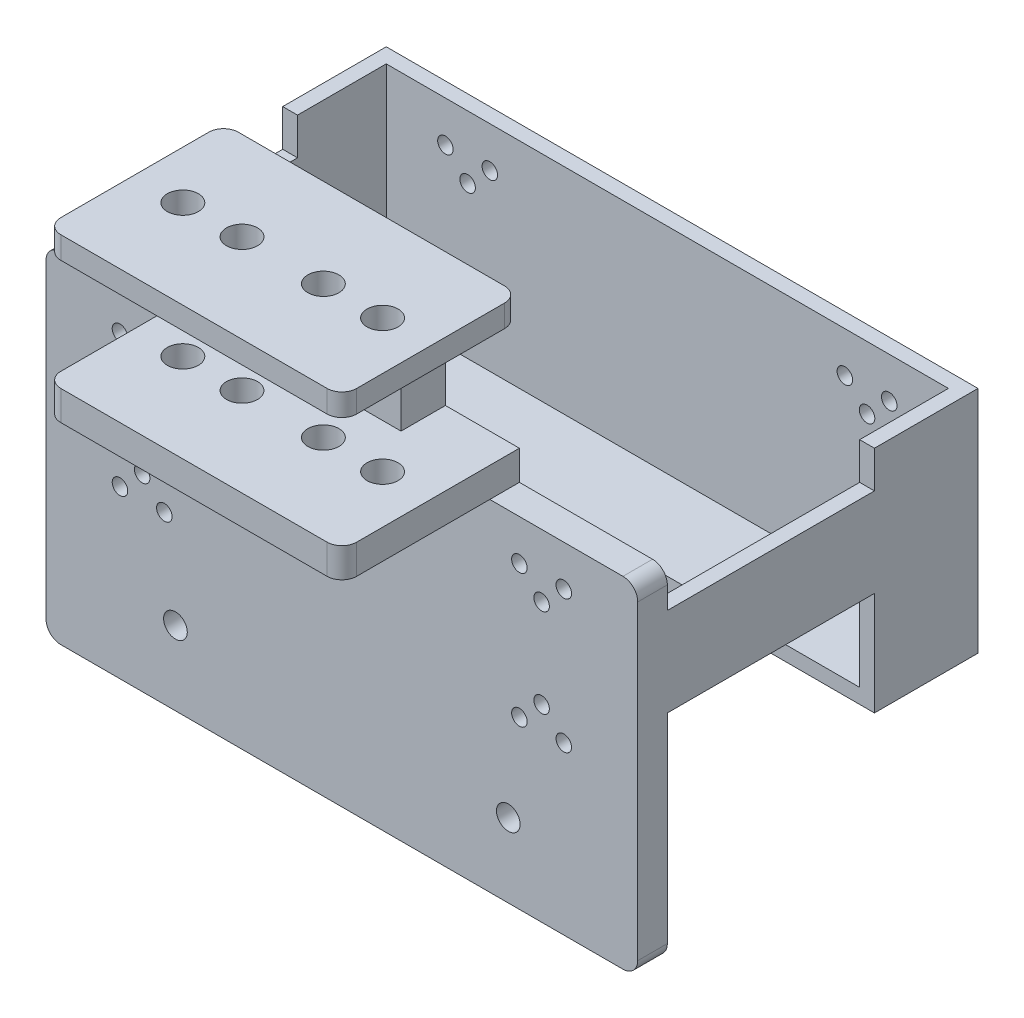
from build123d import *

# Parameters (mm, degrees)
SKETCH_1_W                      = 80
SKETCH_1_H                      = 29
EXTRUDE_1_DEPTH                 = 2
SKETCH_4_W                      = 2
SKETCH_4_H                      = 29
EXTRUDE_2_DEPTH                 = 12
SKETCH_6_W                      = 80
SKETCH_6_H                      = 14
EXTRUDE_4_DEPTH                 = 2
SKETCH_7_W                      = 2
SKETCH_7_H                      = 12
EXTRUDE_5_DEPTH                 = 28
SKETCH_8_W                      = 80
SKETCH_8_H                      = 31
EXTRUDE_6_DEPTH                 = 4
SKETCH_2_R                      = 1.05
CUT_EXTRUDE_1_DEPTH             = 62.711020086
CUT_EXTRUDE_1_DIRECTION_2_REACH = 63.711
SKETCH_12_W                     = 40
SKETCH_12_H                     = 24
EXTRUDE_9_DEPTH                 = 4
CUT_EXTRUDE_3_REACH             = 86.741
SKETCH_13_R                     = 2.1
CUT_EXTRUDE_3_DIRECTION_2_DEPTH = 85.74078121
SKETCH_14_W                     = 20
SKETCH_14_H                     = 6
EXTRUDE_10_DEPTH                = 15
SKETCH_15_W                     = 40
SKETCH_15_H                     = 24
EXTRUDE_11_DEPTH                = 3
SKETCH_16_R                     = 2.1
CUT_EXTRUDE_4_DEPTH             = 3
EXTRUDE_14_DEPTH                = 4
SKETCH_22_R                     = 1.6
CUT_EXTRUDE_5_DEPTH             = 4
FILLET_1_R                      = 2


with BuildPart() as part:
    # 草图1 → 凸台-拉伸1 (new body)
    with BuildSketch(Plane.XY):
        Rectangle(SKETCH_1_W, SKETCH_1_H)
    extrude(amount=EXTRUDE_1_DEPTH)

    # 草图4 → 凸台-拉伸2 (add)
    with BuildSketch(Plane.XY.offset(2)):
        with Locations((39, 0)):
            Rectangle(SKETCH_4_W, SKETCH_4_H)
        with Locations((-39, 0)):
            Rectangle(SKETCH_4_W, SKETCH_4_H)
    extrude(amount=EXTRUDE_2_DEPTH)

    # 草图6 → 凸台-拉伸4 (add)
    with BuildSketch(Plane.XZ.offset(14.5)):
        with Locations((0, 7)):
            Rectangle(SKETCH_6_W, SKETCH_6_H)
    extrude(amount=EXTRUDE_4_DEPTH)

    # 草图7 → 凸台-拉伸5 (add)
    with BuildSketch(Plane.XY.offset(14)):
        with Locations((-39, 3.5)):
            Rectangle(SKETCH_7_W, SKETCH_7_H)
        with Locations((39, 3.5)):
            Rectangle(SKETCH_7_W, SKETCH_7_H)
    extrude(amount=EXTRUDE_5_DEPTH)

    # 草图8 → 凸台-拉伸6 (add)
    with BuildSketch(Plane.XY.offset(42)):
        with Locations((0, -1)):
            Rectangle(SKETCH_8_W, SKETCH_8_H)
    extrude(amount=EXTRUDE_6_DEPTH)

    # 草图2 → 切除-拉伸1 (cut)
    with BuildSketch(Plane.XY.offset(2)):
        with Locations((-30, 9)):
            Circle(SKETCH_2_R)
        with Locations((-24, 9)):
            Circle(SKETCH_2_R)
        with Locations((-27, 6)):
            Circle(SKETCH_2_R)
        with Locations((-27, -6)):
            Circle(SKETCH_2_R)
        with Locations((-24, -9)):
            Circle(SKETCH_2_R)
        with Locations((-30, -9)):
            Circle(SKETCH_2_R)
        with Locations((27, -6)):
            Circle(SKETCH_2_R)
        with Locations((30, -9)):
            Circle(SKETCH_2_R)
        with Locations((24, -9)):
            Circle(SKETCH_2_R)
        with Locations((27, 6)):
            Circle(SKETCH_2_R)
        with Locations((30, 9)):
            Circle(SKETCH_2_R)
        with Locations((24, 9)):
            Circle(SKETCH_2_R)
    extrude(amount=-CUT_EXTRUDE_1_DEPTH, mode=Mode.SUBTRACT)

    # 切除-拉伸1 direction 2: up to this face of the body (flat: up to its plane)
    cut_extrude_1_direction_2_end = Plane(part.part.faces().sort_by_distance((0, -1, 46))[0])
    # 草图2 → 切除-拉伸1 direction 2 (cut, up to the picked face)
    with BuildSketch(Plane.XY.offset(2), mode=Mode.PRIVATE) as cut_extrude_1_direction_2_sk1:
        with Locations((-30, 9)):
            Circle(SKETCH_2_R)
    cut_extrude_1_direction_2_tool1 = split(extrude(cut_extrude_1_direction_2_sk1.sketch, amount=CUT_EXTRUDE_1_DIRECTION_2_REACH, mode=Mode.PRIVATE), bisect_by=cut_extrude_1_direction_2_end, keep=Keep.BOTH, mode=Mode.PRIVATE)
    # 草图2 → 切除-拉伸1 direction 2 (cut, up to the picked face)
    with BuildSketch(Plane.XY.offset(2), mode=Mode.PRIVATE) as cut_extrude_1_direction_2_sk2:
        with Locations((-24, 9)):
            Circle(SKETCH_2_R)
    cut_extrude_1_direction_2_tool2 = split(extrude(cut_extrude_1_direction_2_sk2.sketch, amount=CUT_EXTRUDE_1_DIRECTION_2_REACH, mode=Mode.PRIVATE), bisect_by=cut_extrude_1_direction_2_end, keep=Keep.BOTH, mode=Mode.PRIVATE)
    # 草图2 → 切除-拉伸1 direction 2 (cut, up to the picked face)
    with BuildSketch(Plane.XY.offset(2), mode=Mode.PRIVATE) as cut_extrude_1_direction_2_sk3:
        with Locations((-27, 6)):
            Circle(SKETCH_2_R)
    cut_extrude_1_direction_2_tool3 = split(extrude(cut_extrude_1_direction_2_sk3.sketch, amount=CUT_EXTRUDE_1_DIRECTION_2_REACH, mode=Mode.PRIVATE), bisect_by=cut_extrude_1_direction_2_end, keep=Keep.BOTH, mode=Mode.PRIVATE)
    # 草图2 → 切除-拉伸1 direction 2 (cut, up to the picked face)
    with BuildSketch(Plane.XY.offset(2), mode=Mode.PRIVATE) as cut_extrude_1_direction_2_sk4:
        with Locations((-27, -6)):
            Circle(SKETCH_2_R)
    cut_extrude_1_direction_2_tool4 = split(extrude(cut_extrude_1_direction_2_sk4.sketch, amount=CUT_EXTRUDE_1_DIRECTION_2_REACH, mode=Mode.PRIVATE), bisect_by=cut_extrude_1_direction_2_end, keep=Keep.BOTH, mode=Mode.PRIVATE)
    # 草图2 → 切除-拉伸1 direction 2 (cut, up to the picked face)
    with BuildSketch(Plane.XY.offset(2), mode=Mode.PRIVATE) as cut_extrude_1_direction_2_sk5:
        with Locations((-24, -9)):
            Circle(SKETCH_2_R)
    cut_extrude_1_direction_2_tool5 = split(extrude(cut_extrude_1_direction_2_sk5.sketch, amount=CUT_EXTRUDE_1_DIRECTION_2_REACH, mode=Mode.PRIVATE), bisect_by=cut_extrude_1_direction_2_end, keep=Keep.BOTH, mode=Mode.PRIVATE)
    # 草图2 → 切除-拉伸1 direction 2 (cut, up to the picked face)
    with BuildSketch(Plane.XY.offset(2), mode=Mode.PRIVATE) as cut_extrude_1_direction_2_sk6:
        with Locations((-30, -9)):
            Circle(SKETCH_2_R)
    cut_extrude_1_direction_2_tool6 = split(extrude(cut_extrude_1_direction_2_sk6.sketch, amount=CUT_EXTRUDE_1_DIRECTION_2_REACH, mode=Mode.PRIVATE), bisect_by=cut_extrude_1_direction_2_end, keep=Keep.BOTH, mode=Mode.PRIVATE)
    # 草图2 → 切除-拉伸1 direction 2 (cut, up to the picked face)
    with BuildSketch(Plane.XY.offset(2), mode=Mode.PRIVATE) as cut_extrude_1_direction_2_sk7:
        with Locations((27, -6)):
            Circle(SKETCH_2_R)
    cut_extrude_1_direction_2_tool7 = split(extrude(cut_extrude_1_direction_2_sk7.sketch, amount=CUT_EXTRUDE_1_DIRECTION_2_REACH, mode=Mode.PRIVATE), bisect_by=cut_extrude_1_direction_2_end, keep=Keep.BOTH, mode=Mode.PRIVATE)
    # 草图2 → 切除-拉伸1 direction 2 (cut, up to the picked face)
    with BuildSketch(Plane.XY.offset(2), mode=Mode.PRIVATE) as cut_extrude_1_direction_2_sk8:
        with Locations((30, -9)):
            Circle(SKETCH_2_R)
    cut_extrude_1_direction_2_tool8 = split(extrude(cut_extrude_1_direction_2_sk8.sketch, amount=CUT_EXTRUDE_1_DIRECTION_2_REACH, mode=Mode.PRIVATE), bisect_by=cut_extrude_1_direction_2_end, keep=Keep.BOTH, mode=Mode.PRIVATE)
    # 草图2 → 切除-拉伸1 direction 2 (cut, up to the picked face)
    with BuildSketch(Plane.XY.offset(2), mode=Mode.PRIVATE) as cut_extrude_1_direction_2_sk9:
        with Locations((24, -9)):
            Circle(SKETCH_2_R)
    cut_extrude_1_direction_2_tool9 = split(extrude(cut_extrude_1_direction_2_sk9.sketch, amount=CUT_EXTRUDE_1_DIRECTION_2_REACH, mode=Mode.PRIVATE), bisect_by=cut_extrude_1_direction_2_end, keep=Keep.BOTH, mode=Mode.PRIVATE)
    # 草图2 → 切除-拉伸1 direction 2 (cut, up to the picked face)
    with BuildSketch(Plane.XY.offset(2), mode=Mode.PRIVATE) as cut_extrude_1_direction_2_sk10:
        with Locations((27, 6)):
            Circle(SKETCH_2_R)
    cut_extrude_1_direction_2_tool10 = split(extrude(cut_extrude_1_direction_2_sk10.sketch, amount=CUT_EXTRUDE_1_DIRECTION_2_REACH, mode=Mode.PRIVATE), bisect_by=cut_extrude_1_direction_2_end, keep=Keep.BOTH, mode=Mode.PRIVATE)
    # 草图2 → 切除-拉伸1 direction 2 (cut, up to the picked face)
    with BuildSketch(Plane.XY.offset(2), mode=Mode.PRIVATE) as cut_extrude_1_direction_2_sk11:
        with Locations((30, 9)):
            Circle(SKETCH_2_R)
    cut_extrude_1_direction_2_tool11 = split(extrude(cut_extrude_1_direction_2_sk11.sketch, amount=CUT_EXTRUDE_1_DIRECTION_2_REACH, mode=Mode.PRIVATE), bisect_by=cut_extrude_1_direction_2_end, keep=Keep.BOTH, mode=Mode.PRIVATE)
    # 草图2 → 切除-拉伸1 direction 2 (cut, up to the picked face)
    with BuildSketch(Plane.XY.offset(2), mode=Mode.PRIVATE) as cut_extrude_1_direction_2_sk12:
        with Locations((24, 9)):
            Circle(SKETCH_2_R)
    cut_extrude_1_direction_2_tool12 = split(extrude(cut_extrude_1_direction_2_sk12.sketch, amount=CUT_EXTRUDE_1_DIRECTION_2_REACH, mode=Mode.PRIVATE), bisect_by=cut_extrude_1_direction_2_end, keep=Keep.BOTH, mode=Mode.PRIVATE)
    add(cut_extrude_1_direction_2_tool1.solids().sort_by(Axis((-30, 9, 2), (0, 0, 1)))[0], mode=Mode.SUBTRACT)
    add(cut_extrude_1_direction_2_tool2.solids().sort_by(Axis((-24, 9, 2), (0, 0, 1)))[0], mode=Mode.SUBTRACT)
    add(cut_extrude_1_direction_2_tool3.solids().sort_by(Axis((-27, 6, 2), (0, 0, 1)))[0], mode=Mode.SUBTRACT)
    add(cut_extrude_1_direction_2_tool4.solids().sort_by(Axis((-27, -6, 2), (0, 0, 1)))[0], mode=Mode.SUBTRACT)
    add(cut_extrude_1_direction_2_tool5.solids().sort_by(Axis((-24, -9, 2), (0, 0, 1)))[0], mode=Mode.SUBTRACT)
    add(cut_extrude_1_direction_2_tool6.solids().sort_by(Axis((-30, -9, 2), (0, 0, 1)))[0], mode=Mode.SUBTRACT)
    add(cut_extrude_1_direction_2_tool7.solids().sort_by(Axis((27, -6, 2), (0, 0, 1)))[0], mode=Mode.SUBTRACT)
    add(cut_extrude_1_direction_2_tool8.solids().sort_by(Axis((30, -9, 2), (0, 0, 1)))[0], mode=Mode.SUBTRACT)
    add(cut_extrude_1_direction_2_tool9.solids().sort_by(Axis((24, -9, 2), (0, 0, 1)))[0], mode=Mode.SUBTRACT)
    add(cut_extrude_1_direction_2_tool10.solids().sort_by(Axis((27, 6, 2), (0, 0, 1)))[0], mode=Mode.SUBTRACT)
    add(cut_extrude_1_direction_2_tool11.solids().sort_by(Axis((30, 9, 2), (0, 0, 1)))[0], mode=Mode.SUBTRACT)
    add(cut_extrude_1_direction_2_tool12.solids().sort_by(Axis((24, 9, 2), (0, 0, 1)))[0], mode=Mode.SUBTRACT)

    # 草图12 → 凸台-拉伸9 (add)
    with BuildSketch(Plane(origin=(0, 14.5, 0), x_dir=(1, 0, 0), z_dir=(0, 1, 0))):
        with Locations((0, -54)):
            Rectangle(SKETCH_12_W, SKETCH_12_H)
    extrude(amount=EXTRUDE_9_DEPTH)

    # 草图13 → 切除-拉伸3 (cut, up to next)
    with BuildSketch(Plane(origin=(0, 18.5, 0), x_dir=(1, 0, 0), z_dir=(0, 1, 0)), mode=Mode.PRIVATE) as cut_extrude_3_sk1:
        with Locations(Location((-13.5, -54, 0), (0, 0, 90))):
            Circle(SKETCH_13_R)
    cut_extrude_3_tool1 = extrude(cut_extrude_3_sk1.sketch, amount=-CUT_EXTRUDE_3_REACH, mode=Mode.PRIVATE) & part.part
    # 草图13 → 切除-拉伸3 (cut, up to next)
    with BuildSketch(Plane(origin=(0, 18.5, 0), x_dir=(1, 0, 0), z_dir=(0, 1, 0)), mode=Mode.PRIVATE) as cut_extrude_3_sk2:
        with Locations(Location((-5.5, -54, 0), (0, 0, 90))):
            Circle(SKETCH_13_R)
    cut_extrude_3_tool2 = extrude(cut_extrude_3_sk2.sketch, amount=-CUT_EXTRUDE_3_REACH, mode=Mode.PRIVATE) & part.part
    # 草图13 → 切除-拉伸3 (cut, up to next)
    with BuildSketch(Plane(origin=(0, 18.5, 0), x_dir=(1, 0, 0), z_dir=(0, 1, 0)), mode=Mode.PRIVATE) as cut_extrude_3_sk3:
        with Locations(Location((5.5, -54, 0), (0, 0, 90))):
            Circle(SKETCH_13_R)
    cut_extrude_3_tool3 = extrude(cut_extrude_3_sk3.sketch, amount=-CUT_EXTRUDE_3_REACH, mode=Mode.PRIVATE) & part.part
    # 草图13 → 切除-拉伸3 (cut, up to next)
    with BuildSketch(Plane(origin=(0, 18.5, 0), x_dir=(1, 0, 0), z_dir=(0, 1, 0)), mode=Mode.PRIVATE) as cut_extrude_3_sk4:
        with Locations(Location((13.5, -54, 0), (0, 0, 90))):
            Circle(SKETCH_13_R)
    cut_extrude_3_tool4 = extrude(cut_extrude_3_sk4.sketch, amount=-CUT_EXTRUDE_3_REACH, mode=Mode.PRIVATE) & part.part
    add(cut_extrude_3_tool1.solids().sort_by_distance((-13.5, 18.5, 54))[0], mode=Mode.SUBTRACT)
    add(cut_extrude_3_tool2.solids().sort_by_distance((-5.5, 18.5, 54))[0], mode=Mode.SUBTRACT)
    add(cut_extrude_3_tool3.solids().sort_by_distance((5.5, 18.5, 54))[0], mode=Mode.SUBTRACT)
    add(cut_extrude_3_tool4.solids().sort_by_distance((13.5, 18.5, 54))[0], mode=Mode.SUBTRACT)

    # 草图13 → 切除-拉伸3 direction 2 (cut)
    with BuildSketch(Plane(origin=(0, 18.5, 0), x_dir=(1, 0, 0), z_dir=(0, 1, 0))):
        with Locations(Location((-13.5, -54, 0), (0, 0, 90))):
            Circle(SKETCH_13_R)
        with Locations(Location((-5.5, -54, 0), (0, 0, 90))):
            Circle(SKETCH_13_R)
        with Locations(Location((5.5, -54, 0), (0, 0, 90))):
            Circle(SKETCH_13_R)
        with Locations(Location((13.5, -54, 0), (0, 0, 90))):
            Circle(SKETCH_13_R)
    extrude(amount=CUT_EXTRUDE_3_DIRECTION_2_DEPTH, mode=Mode.SUBTRACT)

    # 草图14 → 凸台-拉伸10 (add)
    with BuildSketch(Plane(origin=(0, 18.5, 0), x_dir=(1, 0, 0), z_dir=(0, 1, 0))):
        with Locations((0, -45)):
            Rectangle(SKETCH_14_W, SKETCH_14_H)
    extrude(amount=EXTRUDE_10_DEPTH)

    # 草图15 → 凸台-拉伸11 (add)
    with BuildSketch(Plane(origin=(0, 33.5, 0), x_dir=(1, 0, 0), z_dir=(0, 1, 0))):
        with Locations((0, -54)):
            Rectangle(SKETCH_15_W, SKETCH_15_H)
    extrude(amount=EXTRUDE_11_DEPTH)

    # 草图16 → 切除-拉伸4 (cut)
    with BuildSketch(Plane(origin=(0, 36.5, 0), x_dir=(1, 0, 0), z_dir=(0, 1, 0))):
        with Locations(Location((-13.5, -54, 0), (0, 0, 90))):
            Circle(SKETCH_16_R)
        with Locations(Location((-5.5, -54, 0), (0, 0, 90))):
            Circle(SKETCH_16_R)
        with Locations(Location((5.5, -54, 0), (0, 0, 90))):
            Circle(SKETCH_16_R)
        with Locations(Location((13.5, -54, 0), (0, 0, 90))):
            Circle(SKETCH_16_R)
    extrude(amount=-CUT_EXTRUDE_4_DEPTH, mode=Mode.SUBTRACT)

    # 草图21 → 凸台-拉伸14 (add)
    with BuildSketch(Plane.XY.offset(46)):
        Polygon((0, -16.5), (40, -16.5), (40, -31.5), (-40, -31.5), (-40, -16.5), align=None)
    extrude(amount=-EXTRUDE_14_DEPTH)

    # 草图22 → 切除-拉伸5 (cut)
    with BuildSketch(Plane.XY.offset(46)):
        with Locations((-22.5, -21.5)):
            Circle(SKETCH_22_R)
        with Locations((22.5, -21.5)):
            Circle(SKETCH_22_R)
    extrude(amount=-CUT_EXTRUDE_5_DEPTH, mode=Mode.SUBTRACT)

    # 圆角1
    fillet_1_edges = [part.edges().sort_by_distance(p)[0] for p in [
        (-20, 16.5, 66),
        (20, 16.5, 66),
        (-20, 35, 42),
        (-20, 35, 66),
        (20, 35, 66),
        (20, 35, 42),
        (40, -31.5, 44),
        (-40, -31.5, 44),
        (-40, 14.5, 44),
        (40, 14.5, 44),
    ]]
    fillet(fillet_1_edges, radius=FILLET_1_R)


solid = part.part
